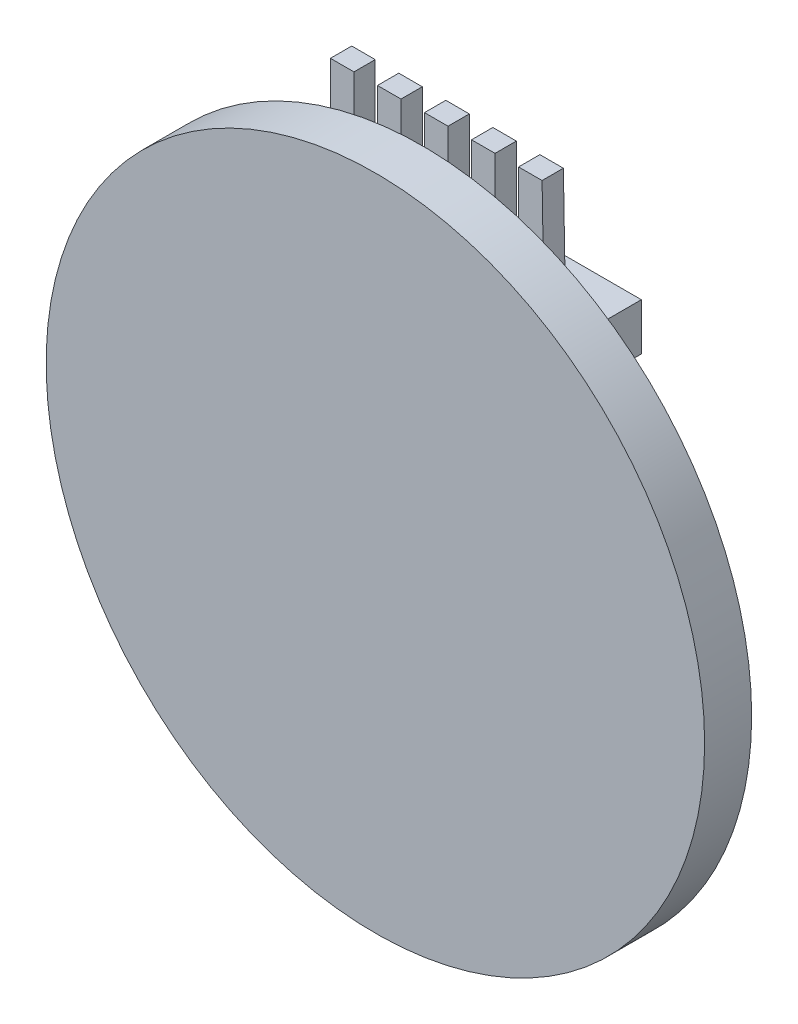
from build123d import *

# Parameters (mm, degrees)
SKETCH1_R           = 7
BOSS_EXTRUDE1_DEPTH = 1
SKETCH2_W           = 5
SKETCH2_H           = 1
BOSS_EXTRUDE2_DEPTH = 2
SKETCH3_W           = 0.5
SKETCH3_H           = 0.452823542
BOSS_EXTRUDE3_DEPTH = 3
DRAFT9_ANGLE        = 1


with BuildPart() as part:
    # Sketch1 → Boss-Extrude1 (new body)
    with BuildSketch(Plane.XY):
        Circle(SKETCH1_R)
    extrude(amount=BOSS_EXTRUDE1_DEPTH)

    # Sketch2 → Boss-Extrude2 (add)
    with BuildSketch(Plane(origin=(0, 0, 0), x_dir=(-1, 0, 0), z_dir=(0, 0, -1))):
        with Locations((-0.154644107, 3.992933826)):
            Rectangle(SKETCH2_W, SKETCH2_H)
    extrude(amount=BOSS_EXTRUDE2_DEPTH)

    # Sketch3 → Boss-Extrude3 (add)
    with BuildSketch(Plane(origin=(0, 4.492933826, 0), x_dir=(1, 0, 0), z_dir=(0, 1, 0))):
        with Locations((1.154644107, 0.365882794)):
            Rectangle(SKETCH3_W, SKETCH3_H)
        with Locations((2.154644107, 0.365882794)):
            Rectangle(SKETCH3_W, SKETCH3_H)
        with Locations((0.154644107, 0.365882794)):
            Rectangle(SKETCH3_W, SKETCH3_H)
        with Locations((-0.845355893, 0.365882794)):
            Rectangle(SKETCH3_W, SKETCH3_H)
        with Locations((-1.845355893, 0.365882794)):
            Rectangle(SKETCH3_W, SKETCH3_H)
    extrude(amount=BOSS_EXTRUDE3_DEPTH)

    # Draft9
    draft9_faces = [part.faces().sort_by_distance(p)[0] for p in [
        (2.404644107, 5.992933826, -0.365882794),
    ]]
    draft(draft9_faces, Plane.ZX.offset(7.492933826), DRAFT9_ANGLE)


solid = part.part
